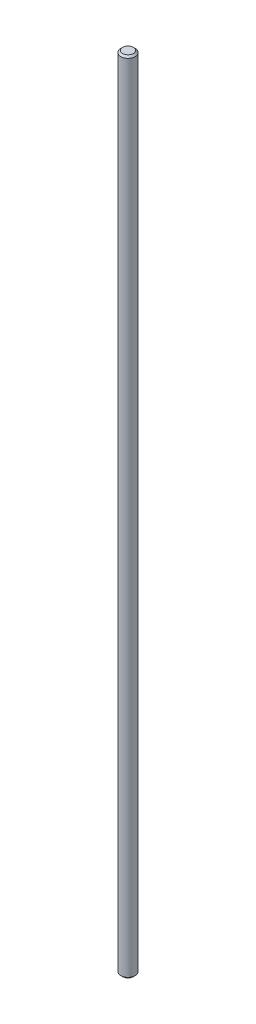
from build123d import *

# Parameters (mm, degrees)
BOSS_EXTRUDE1_DEPTH      = 225
BOSS_EXTRUDE1_DEPTH_BACK = 220
SKETCH1_R                = 4
CHAMFER1_SIZE            = 1


with BuildPart() as part:
    # Sketch1 → Boss-Extrude1 (new, two sides: drawn at the far end of the back side and taken through both)
    with BuildSketch(Plane(origin=(0, 0, 0), x_dir=(1, 0, 0), z_dir=(0, 1, 0)).offset(-BOSS_EXTRUDE1_DEPTH_BACK)):
        with Locations(Location((0, 0, 0), (0, 0, 270))):
            Circle(SKETCH1_R)
    extrude(amount=BOSS_EXTRUDE1_DEPTH + BOSS_EXTRUDE1_DEPTH_BACK)

    # Chamfer1
    chamfer1_edges = [part.edges().sort_by_distance(p)[0] for p in [
        (0, -220, -4),
        (0, 225, -4),
    ]]
    chamfer(chamfer1_edges, length=CHAMFER1_SIZE)


solid = part.part
